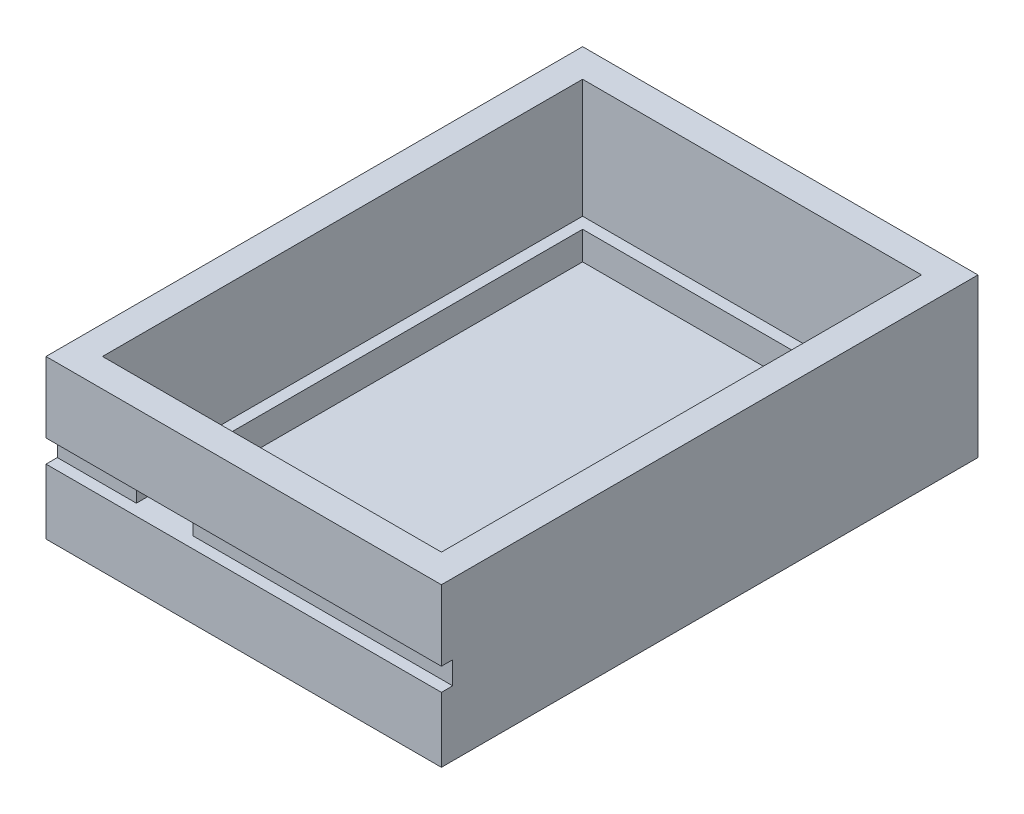
from build123d import *

# Parameters (mm, degrees)
SKETCH1_W         = 60
SKETCH1_H         = 85
FLOOR_2_DEPTH     = 5
SKETCH3_W         = 70
SKETCH3_H         = 95
SKETCH3_W_2       = 60
SKETCH3_H_2       = 85
WALLS_DEPTH       = 28
SKETCH7_W         = 10
SKETCH7_H         = 4
USB_C_DEPTH       = 5
SENSORWALL_DEPTH  = 5
SKETCH8_W         = 70
SKETCH8_H         = 4
WIRESPACING_DEPTH = 2


with BuildPart() as part:
    # Sketch1 → Floor 2 (new body)
    with BuildSketch(Plane(origin=(0, 0, 0), x_dir=(1, 0, 0), z_dir=(0, 1, 0))):
        Rectangle(SKETCH1_W, SKETCH1_H)
    extrude(amount=FLOOR_2_DEPTH)

    # Sketch3 → Walls (add)
    with BuildSketch(Plane(origin=(0, 0, 0), x_dir=(1, 0, 0), z_dir=(0, 1, 0))):
        Rectangle(SKETCH3_W, SKETCH3_H)
        Rectangle(SKETCH3_W_2, SKETCH3_H_2, mode=Mode.SUBTRACT)
    extrude(amount=WALLS_DEPTH)

    # Sketch7 → USB-C (cut)
    with BuildSketch(Plane.XY.offset(47.5)):
        with Locations((-16, 13.5)):
            Rectangle(SKETCH7_W, SKETCH7_H)
    extrude(amount=-USB_C_DEPTH, mode=Mode.SUBTRACT)

    # WallSketch → SensorWall (add)
    with BuildSketch(Plane(origin=(0, 5, 0), x_dir=(1, 0, 0), z_dir=(0, 1, 0))):
        Polygon((-25, -42.5), (-25, 37.5), (25, 37.5), (25, -42.5), (27, -42.5), (27, 39.5), (-27, 39.5), (-27, -42.5), align=None)
    extrude(amount=SENSORWALL_DEPTH)

    # Sketch8 → WireSpacing (cut)
    with BuildSketch(Plane.XY.offset(47.5)):
        with Locations((0, 13.5)):
            Rectangle(SKETCH8_W, SKETCH8_H)
    extrude(amount=-WIRESPACING_DEPTH, mode=Mode.SUBTRACT)


solid = part.part
